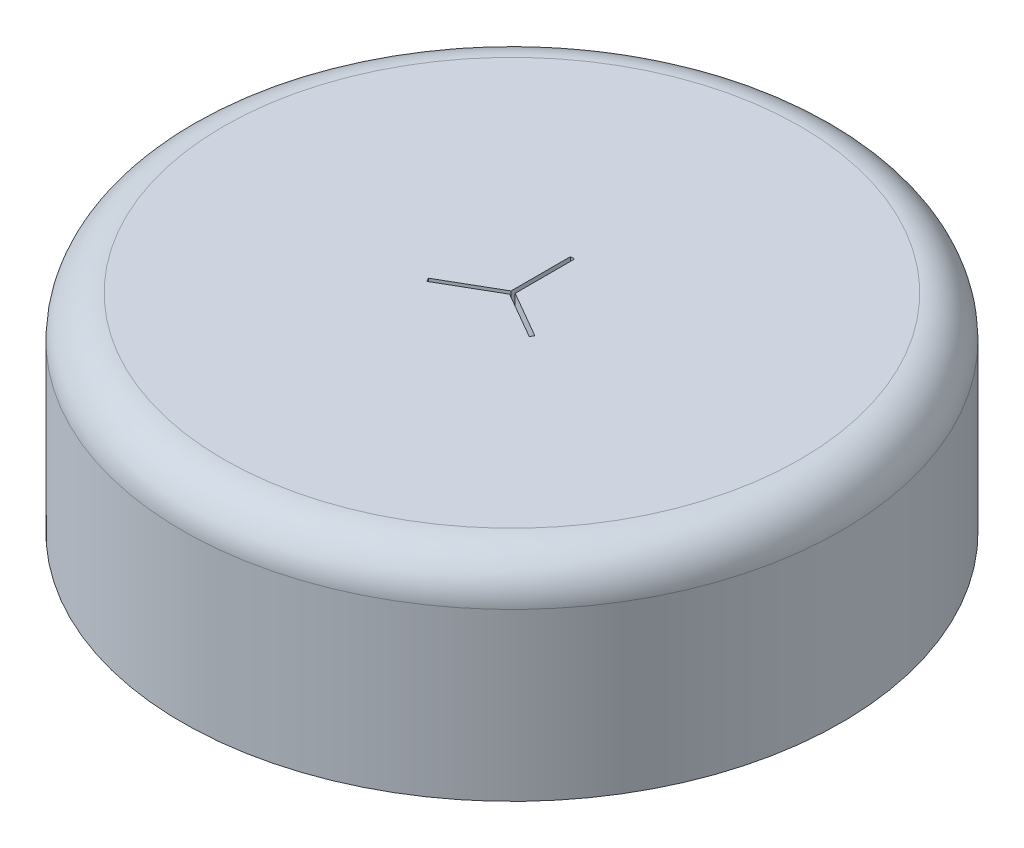
from build123d import *

# Parameters (mm, degrees)
CUT_EXTRUDE_1_DEPTH = 5


with BuildPart() as part:
    # 草图1 → 旋转1 (revolve)
    with BuildSketch(Plane.XY, mode=Mode.PRIVATE) as revolve_1_sk:
        with BuildLine():
            Line((1.4, 3.536467832), (0, 3.536467832))
            Line((0, 3.536467832), (0, 3.456467832))
            Line((0, 3.456467832), (1.025340725, 3.456467832))
            ThreePointArc((1.025340725, 3.456467832), (1.232580693, 3.401271645), (1.384912004, 3.250307427))
            Line((1.384912004, 3.250307427), (1.232407542, 3.250307427))
            Line((1.232407542, 3.250307427), (1.232407542, 3.033675945))
            Line((1.232407542, 3.033675945), (1.017066371, 3.033675945))
            Line((1.017066371, 3.033675945), (1.017066371, 2.862597605))
            Line((1.017066371, 2.862597605), (1.4, 2.862597605))
            Line((1.4, 2.862597605), (1.4, 2.529500902))
            Line((1.4, 2.529500902), (1.6, 2.529500902))
            Line((1.6, 2.529500902), (1.6, 3.336467832))
            ThreePointArc((1.6, 3.336467832), (1.541421356, 3.477889188), (1.4, 3.536467832))
        make_face()
    revolve(revolve_1_sk.sketch.rotate(Axis((0, -6.038326455, 0), (0, 1, 0)), 90), axis=Axis((0, -6.038326455, 0), (0, 1, 0)))

    # 草图2 → 切除-拉伸1 (cut)
    with BuildSketch(Plane(origin=(0, 3.536467832, 0), x_dir=(1, 0, 0), z_dir=(0, 1, 0))):
        Polygon((0, -0.011547005), (-0.254294351, -0.158363917), (-0.264294351, -0.141043409), (-0.01, 0.005773503), (-0.01, 0.294280869), (0.01, 0.294280869), (0.01, 0.005773503), (0.236087164, -0.124757983), (0.226087164, -0.142078491), align=None)
    extrude(amount=-CUT_EXTRUDE_1_DEPTH, mode=Mode.SUBTRACT)


solid = part.part
